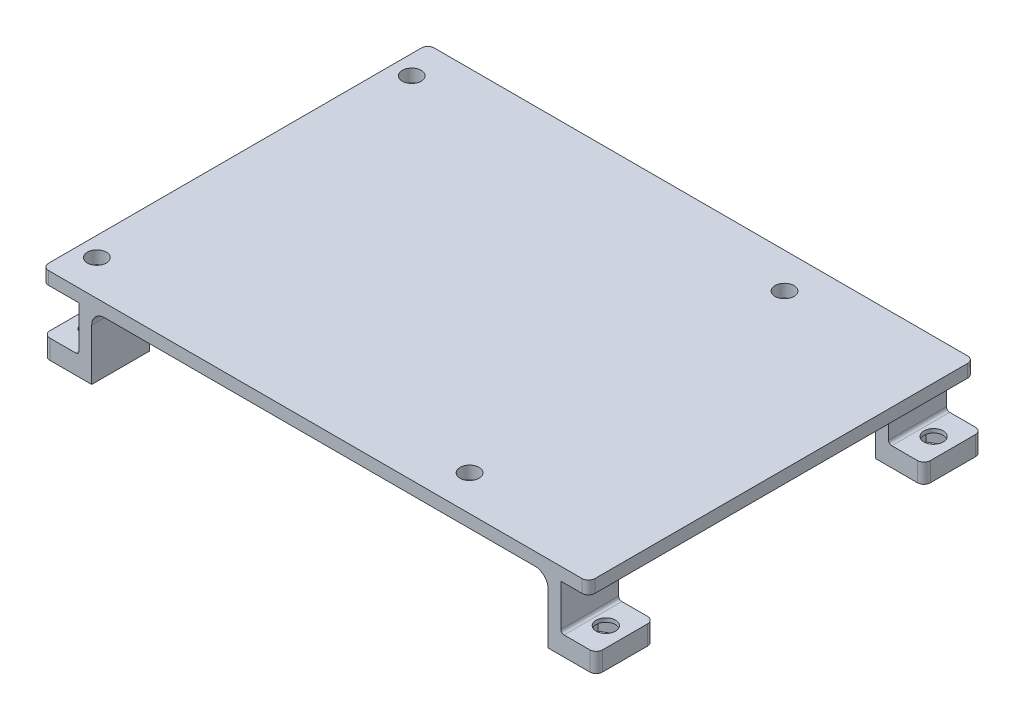
from build123d import *

# Parameters (mm, degrees)
EXTRUDE_1_DEPTH          = 30
CUT_EXTRUDE_1_DEPTH      = 54.946640303
CUT_EXTRUDE_1_DEPTH_BACK = 54.946640303
SKETCH_2_W               = 42
SKETCH_2_H               = 12
CUT_EXTRUDE_4_REACH      = 55.947
SKETCH_3_R               = 1.5
SKETCH_5_R               = 1.475
CUT_EXTRUDE_5_DEPTH      = 5
CUT_EXTRUDE_7_DEPTH      = 2.4
FILLET_1_R               = 1
FILLET_5_R               = 0.5
FILLET_7_R               = 2


with BuildPart() as part:
    # 草圖1 → 填料-伸長1 (new, symmetric)
    with BuildSketch(Plane.XY):
        Polygon((-43, 0), (-43, 3), (-37.5, 3), (-37.5, 10), (-43.2, 10), (-43.2, 12), (41.8, 12), (41.8, 10), (37.5, 10), (37.5, 3), (43, 3), (43, 0), (35.5, 0), (35.5, 10), (-35.5, 10), (-35.5, 0), align=None)
    extrude(amount=EXTRUDE_1_DEPTH, both=True)

    # 草圖2 → 除料-伸長1 (cut, two sides: drawn at the far end of the back side and taken through both)
    with BuildSketch(Plane(origin=(0, 0, 0), x_dir=(0, 0, -1), z_dir=(1, 0, 0)).offset(-CUT_EXTRUDE_1_DEPTH_BACK)):
        Rectangle(SKETCH_2_W, SKETCH_2_H)
    extrude(amount=CUT_EXTRUDE_1_DEPTH + CUT_EXTRUDE_1_DEPTH_BACK, mode=Mode.SUBTRACT)

    # 草圖3 → 除料-伸長4 (cut, up to next)
    with BuildSketch(Plane(origin=(0, 0, 0), x_dir=(1, 0, 0), z_dir=(0, 1, 0)), mode=Mode.PRIVATE) as cut_extrude_4_sk1:
        with Locations(Location((-40, 25.5, 0), (0, 0, 90))):
            Circle(SKETCH_3_R)
    cut_extrude_4_tool1 = extrude(cut_extrude_4_sk1.sketch, amount=CUT_EXTRUDE_4_REACH, mode=Mode.PRIVATE) & part.part
    # 草圖3 → 除料-伸長4 (cut, up to next)
    with BuildSketch(Plane(origin=(0, 0, 0), x_dir=(1, 0, 0), z_dir=(0, 1, 0)), mode=Mode.PRIVATE) as cut_extrude_4_sk2:
        with Locations(Location((40, 25.5, 0), (0, 0, 90))):
            Circle(SKETCH_3_R)
    cut_extrude_4_tool2 = extrude(cut_extrude_4_sk2.sketch, amount=CUT_EXTRUDE_4_REACH, mode=Mode.PRIVATE) & part.part
    # 草圖3 → 除料-伸長4 (cut, up to next)
    with BuildSketch(Plane(origin=(0, 0, 0), x_dir=(1, 0, 0), z_dir=(0, 1, 0)), mode=Mode.PRIVATE) as cut_extrude_4_sk3:
        with Locations(Location((40, -25.5, 0), (0, 0, 90))):
            Circle(SKETCH_3_R)
    cut_extrude_4_tool3 = extrude(cut_extrude_4_sk3.sketch, amount=CUT_EXTRUDE_4_REACH, mode=Mode.PRIVATE) & part.part
    # 草圖3 → 除料-伸長4 (cut, up to next)
    with BuildSketch(Plane(origin=(0, 0, 0), x_dir=(1, 0, 0), z_dir=(0, 1, 0)), mode=Mode.PRIVATE) as cut_extrude_4_sk4:
        with Locations(Location((-40, -25.5, 0), (0, 0, 90))):
            Circle(SKETCH_3_R)
    cut_extrude_4_tool4 = extrude(cut_extrude_4_sk4.sketch, amount=CUT_EXTRUDE_4_REACH, mode=Mode.PRIVATE) & part.part
    add(cut_extrude_4_tool1.solids().sort_by_distance((-40, 0, -25.5))[0], mode=Mode.SUBTRACT)
    add(cut_extrude_4_tool2.solids().sort_by_distance((40, 0, -25.5))[0], mode=Mode.SUBTRACT)
    add(cut_extrude_4_tool3.solids().sort_by_distance((40, 0, 25.5))[0], mode=Mode.SUBTRACT)
    add(cut_extrude_4_tool4.solids().sort_by_distance((-40, 0, 25.5))[0], mode=Mode.SUBTRACT)

    # 草圖5 → 除料-伸長5 (cut)
    with BuildSketch(Plane(origin=(0, 12, 0), x_dir=(1, 0, 0), z_dir=(0, 1, 0))):
        with Locations(Location((-40.2, 24.5, 0), (0, 0, 270))):
            Circle(SKETCH_5_R)
        with Locations(Location((-40.2, -24.5, 0), (0, 0, 270))):
            Circle(SKETCH_5_R)
        with Locations(Location((17.8, 24.5, 0), (0, 0, 270))):
            Circle(SKETCH_5_R)
        with Locations(Location((17.8, -24.5, 0), (0, 0, 270))):
            Circle(SKETCH_5_R)
    extrude(amount=-CUT_EXTRUDE_5_DEPTH, mode=Mode.SUBTRACT)

    # 草圖16 → 除料-伸長7 (cut)
    with BuildSketch(Plane.XZ):
        Polygon((-40, 22.209103466), (-37.15, 23.854551733), (-37.15, 27.145448267), (-40, 28.790896534), (-42.85, 27.145448267), (-42.85, 23.854551733), align=None)
        Polygon((-42.85, -23.854551733), (-40, -22.209103466), (-37.15, -23.854551733), (-37.15, -27.145448267), (-40, -28.790896534), (-42.85, -27.145448267), align=None)
        Polygon((40, -22.209103466), (37.15, -23.854551733), (37.15, -27.145448267), (40, -28.790896534), (42.85, -27.145448267), (42.85, -23.854551733), align=None)
        Polygon((42.85, 23.854551733), (40, 22.209103466), (37.15, 23.854551733), (37.15, 27.145448267), (40, 28.790896534), (42.85, 27.145448267), align=None)
    extrude(amount=-CUT_EXTRUDE_7_DEPTH, mode=Mode.SUBTRACT)

    # 圓角1
    fillet_1_edges = [part.edges().sort_by_distance(p)[0] for p in [
        (-43, 1.5, -30),
        (-43.2, 11, -30),
        (41.8, 11, -30),
        (43, 1.5, -30),
        (43, 1.5, 30),
        (41.8, 11, 30),
        (-43, 1.5, 21),
        (-43, 1.5, -21),
        (-43.2, 11, 30),
        (43, 1.5, -21),
        (43, 1.5, 21),
        (-43, 1.5, 30),
    ]]
    fillet(fillet_1_edges, radius=FILLET_1_R)

    # 圓角5
    fillet_5_edges = [part.edges().sort_by_distance(p)[0] for p in [
        (-37.5, 3, 25.5),
        (37.5, 3, 25.5),
        (-37.5, 3, -25.5),
        (37.5, 3, -25.5),
    ]]
    fillet(fillet_5_edges, radius=FILLET_5_R)

    # 圓角7
    fillet_7_edges = [part.edges().sort_by_distance(p)[0] for p in [
        (35.5, 10, 0),
        (-35.5, 10, 0),
    ]]
    fillet(fillet_7_edges, radius=FILLET_7_R)


solid = part.part
